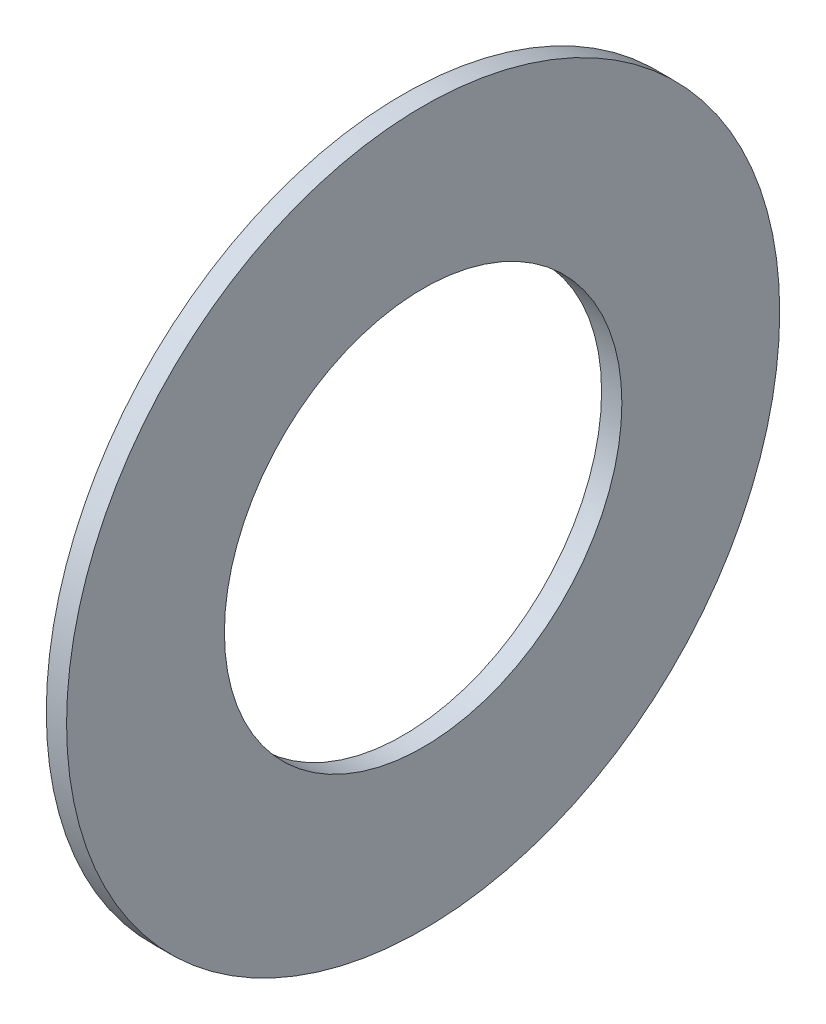
from build123d import *

# Parameters (mm, degrees)
SKETCH1_R      = 14.2875
SKETCH1_R_2    = 7.9629
EXTRUDE1_DEPTH = 0.8128


with BuildPart() as part:
    # Sketch1 → Extrude1 (new body)
    with BuildSketch(Plane(origin=(0, 0, 0), x_dir=(0, 0, -1), z_dir=(1, 0, 0))):
        Circle(SKETCH1_R)
        Circle(SKETCH1_R_2, mode=Mode.SUBTRACT)
    extrude(amount=EXTRUDE1_DEPTH)


solid = part.part
